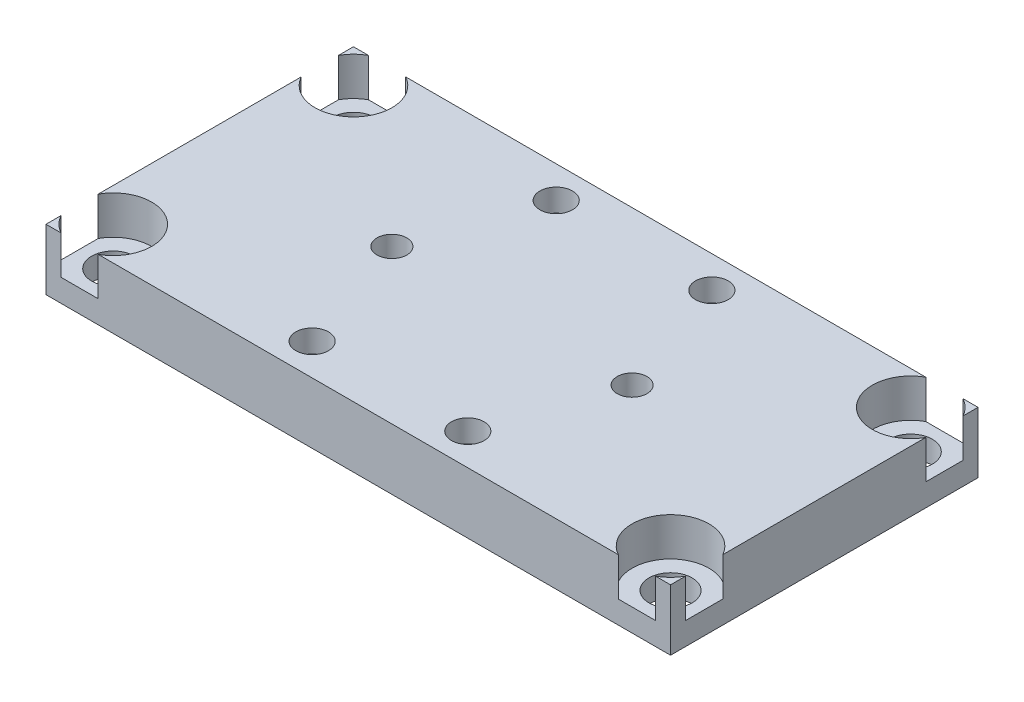
from build123d import *

# Parameters (mm, degrees)
SKETCH1_W                      = 65
SKETCH1_H                      = 32
EXTRUDE1_DEPTH                 = 6.35
CBORE_FOR_M4_SHCS1_D           = 4.5
CBORE_FOR_M4_SHCS1_CBORE_D     = 8
CBORE_FOR_M4_SHCS1_CBORE_DEPTH = 4
LPATTERN2_COUNT                = 2
LPATTERN2_PITCH                = 58
LPATTERN2_COUNT_DIR2           = 2
LPATTERN2_PITCH_DIR2           = 25
CBORE_FOR_M3_SHCS1_D           = 3.4
CBORE_FOR_M3_SHCS1_CBORE_D     = 6.5
CBORE_FOR_M3_SHCS1_CBORE_DEPTH = 4
LPATTERN3_COUNT                = 2
LPATTERN3_PITCH                = 16.2
LPATTERN3_COUNT_DIR2           = 2
LPATTERN3_PITCH_DIR2           = 25.4
LPATTERN4_COUNT                = 2
LPATTERN4_PITCH                = 25


with BuildPart() as part:
    # Sketch1 → Extrude1 (new body)
    with BuildSketch(Plane(origin=(0, 0, 0), x_dir=(1, 0, 0), z_dir=(0, 1, 0))):
        Rectangle(SKETCH1_W, SKETCH1_H)
    extrude(amount=EXTRUDE1_DEPTH)

    # CBORE for M4 SHCS1 (through all)
    with Locations(Plane(origin=(-29, 6.35, -12.5), x_dir=(0, 0, 1), z_dir=(0, 1, 0))):
        with Locations((0, 0)):
            cbore_for_m4_shcs1 = CounterBoreHole(CBORE_FOR_M4_SHCS1_D / 2, CBORE_FOR_M4_SHCS1_CBORE_D / 2, CBORE_FOR_M4_SHCS1_CBORE_DEPTH)

    # LPattern2: CBORE for M4 SHCS1 2 × 2
    with Locations(*[(i * LPATTERN2_PITCH, 0, j * LPATTERN2_PITCH_DIR2) for i in range(LPATTERN2_COUNT) for j in range(LPATTERN2_COUNT_DIR2) if (i, j) != (0, 0)]):
        add(cbore_for_m4_shcs1, mode=Mode.SUBTRACT)

    # CBORE for M3 SHCS1 (through all)
    with Locations(Plane(origin=(-8.1, 0, 12.7), x_dir=(0, 0, -1), z_dir=(0, -1, 0))):
        with Locations((0, 0)):
            cbore_for_m3_shcs1 = CounterBoreHole(CBORE_FOR_M3_SHCS1_D / 2, CBORE_FOR_M3_SHCS1_CBORE_D / 2, CBORE_FOR_M3_SHCS1_CBORE_DEPTH)

    # LPattern3: CBORE for M3 SHCS1 2 × 2
    with Locations(*[(i * LPATTERN3_PITCH, 0, -j * LPATTERN3_PITCH_DIR2) for i in range(LPATTERN3_COUNT) for j in range(LPATTERN3_COUNT_DIR2) if (i, j) != (0, 0)]):
        add(cbore_for_m3_shcs1, mode=Mode.SUBTRACT)

    # Sketch8 → Ø3.1 (3.1) Diameter Hole1 (revolve, cut)
    with BuildSketch(Plane(origin=(-12.5, 6.35, 0), x_dir=(0, 0, 1), z_dir=(1, 0, 0))):
        Polygon((0, 0), (0, 5.931333959), (1.55, 5), (1.55, 0), align=None)
    f_3_1_3_1_diameter_hole1 = revolve(axis=Axis((-12.5, 12.7, 0), (0, -1, 0)), mode=Mode.SUBTRACT)

    # LPattern4: Ø3.1 (3.1) Diameter Hole1 ×2
    with Locations(*[(i * LPATTERN4_PITCH, 0, 0) for i in range(1, LPATTERN4_COUNT)]):
        add(f_3_1_3_1_diameter_hole1, mode=Mode.SUBTRACT)


solid = part.part
